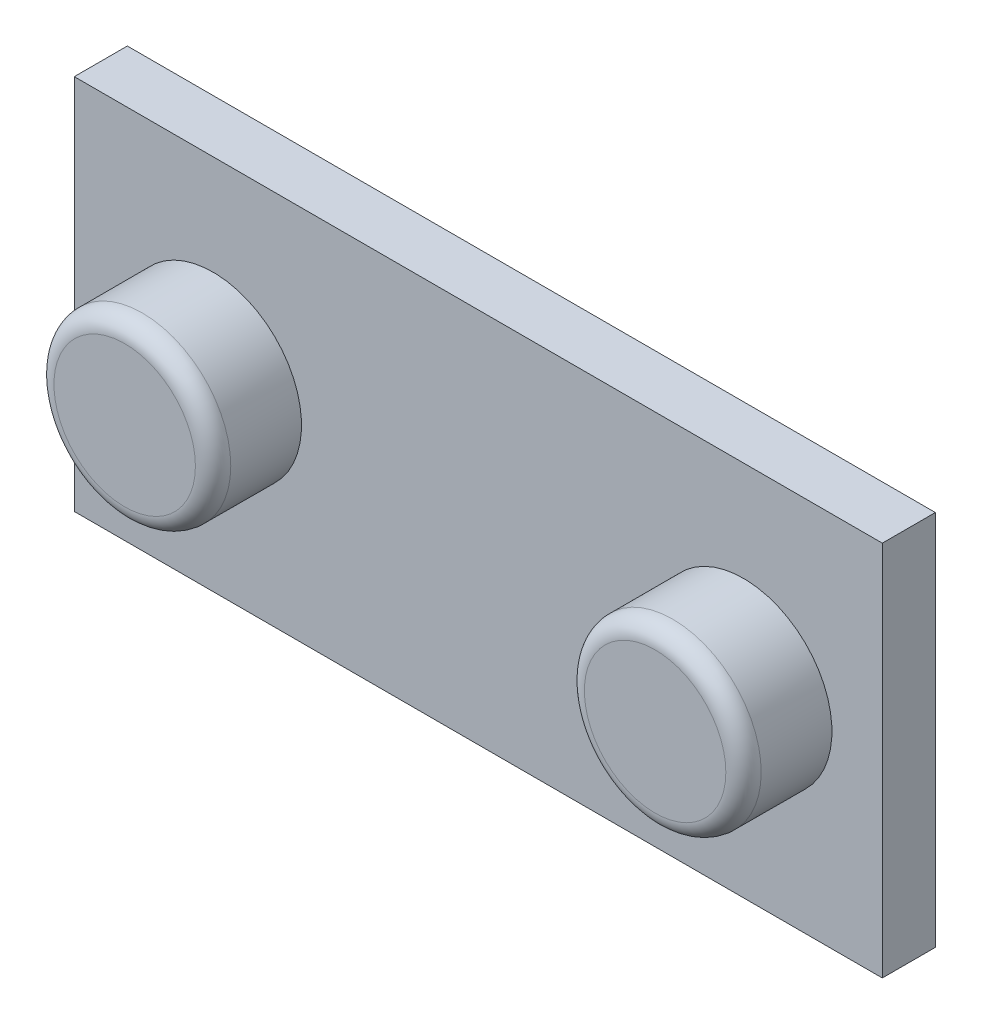
from build123d import *

# Parameters (mm, degrees)
SKETCH1_W           = 45.7
SKETCH1_H           = 21.3
BOSS_EXTRUDE1_DEPTH = 3
SKETCH2_R           = 5
BOSS_EXTRUDE2_DEPTH = 5
FILLET1_R           = 1


with BuildPart() as part:
    # Sketch1 → Boss-Extrude1 (new body)
    with BuildSketch(Plane.XY):
        Rectangle(SKETCH1_W, SKETCH1_H)
    extrude(amount=BOSS_EXTRUDE1_DEPTH)

    # Sketch2 → Boss-Extrude2 (add)
    with BuildSketch(Plane.XY.offset(3)):
        with Locations(Location((-15, 0, 0), (0, 0, 180))):
            Circle(SKETCH2_R)
        with Locations(Location((15, 0, 0), (0, 0, 180))):
            Circle(SKETCH2_R)
    extrude(amount=BOSS_EXTRUDE2_DEPTH)

    # Fillet1
    fillet1_edges = [part.edges().sort_by_distance(p)[0] for p in [
        (-10, 0, 8),
        (20, 0, 8),
    ]]
    fillet(fillet1_edges, radius=FILLET1_R)


solid = part.part
